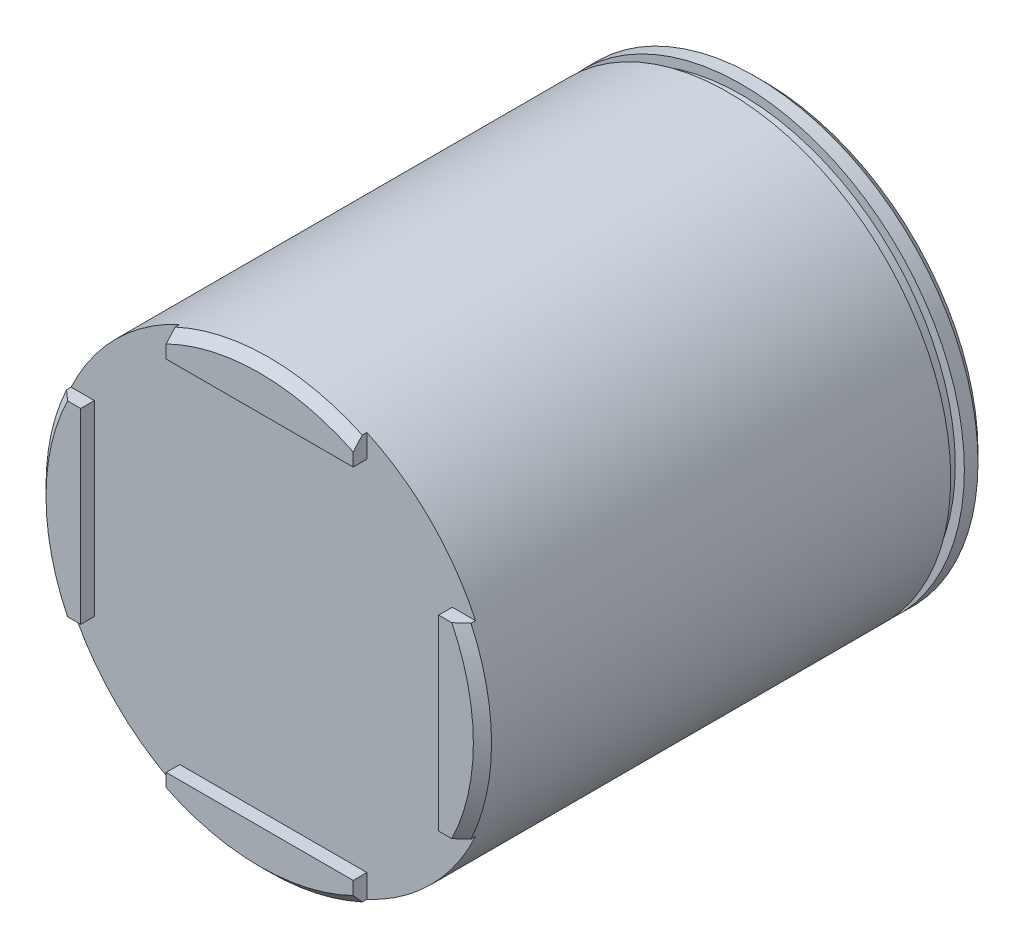
from build123d import *

# Parameters (mm, degrees)
SKETCH2_R                       = 12.446
BOSS_EXTRUDE1_DEPTH             = 28.194
CHAMFER1_SIZE                   = 0.508
F_45_0_082_DIAMETER_HOLE1_D     = 2.0828
F_45_0_082_DIAMETER_HOLE1_DEPTH = 21.59
F_45_0_082_DIAMETER_HOLE1_TIP   = 0.431362004
SKETCH11_W                      = 20
SKETCH11_H                      = 20
CUT_EXTRUDE1_DEPTH              = 0.762
CUT_EXTRUDE2_REACH              = 35.237
SKETCH13_W                      = 22.592421824
SKETCH13_H                      = 4.7752
CUT_EXTRUDE3_REACH              = 35.237
SKETCH14_W                      = 4.7752
SKETCH14_H                      = 22.592421824
CIRPATTERN2_COUNT               = 6
SKETCH18_W                      = 0.762
SKETCH18_H                      = 0.508


with BuildPart() as part:
    # Sketch2 → Boss-Extrude1 (new body)
    with BuildSketch(Plane.XY):
        Circle(SKETCH2_R)
    extrude(amount=BOSS_EXTRUDE1_DEPTH)

    # Chamfer1
    chamfer1_edges = [part.edges().sort_by_distance(p)[0] for p in [
        (-12.446, 0, 0),
        (-12.446, 0, 28.194),
    ]]
    chamfer(chamfer1_edges, length=CHAMFER1_SIZE)

    # #45 (0.082) Diameter Hole1
    with Locations(Plane(origin=(0, 0, 0), x_dir=(-1, 0, 0), z_dir=(0, 0, -1))):
        with Locations((0, 8.255), (-7.149039708, 4.1275), (-7.149039708, -4.1275), (0, -8.255), (7.149039708, -4.1275), (7.149039708, 4.1275)):
            Hole(F_45_0_082_DIAMETER_HOLE1_D / 2, depth=F_45_0_082_DIAMETER_HOLE1_DEPTH)
            with Locations((0, 0, -(F_45_0_082_DIAMETER_HOLE1_DEPTH + F_45_0_082_DIAMETER_HOLE1_TIP / 2))):  # 135° drill point
                Cone(0, F_45_0_082_DIAMETER_HOLE1_D / 2, F_45_0_082_DIAMETER_HOLE1_TIP, mode=Mode.SUBTRACT)

    # Sketch11 → Cut-Extrude1 (cut)
    with BuildSketch(Plane.XY.offset(28.194)):
        Rectangle(SKETCH11_W, SKETCH11_H)
    extrude(amount=-CUT_EXTRUDE1_DEPTH, mode=Mode.SUBTRACT)

    # Cut-Extrude2: up to this face of the body (flat: up to its plane)
    cut_extrude2_end = Plane(part.part.faces().sort_by_distance((0, 0, 27.432))[0])
    # Sketch13 → Cut-Extrude2 (cut, up to the picked face)
    with BuildSketch(Plane.XY.offset(28.194), mode=Mode.PRIVATE) as cut_extrude2_sk1:
        with Locations((0, 7.6124)):
            Rectangle(SKETCH13_W, SKETCH13_H)
    cut_extrude2_tool1 = split(extrude(cut_extrude2_sk1.sketch, amount=-CUT_EXTRUDE2_REACH, mode=Mode.PRIVATE), bisect_by=cut_extrude2_end, keep=Keep.BOTH, mode=Mode.PRIVATE)
    # Sketch13 → Cut-Extrude2 (cut, up to the picked face)
    with BuildSketch(Plane.XY.offset(28.194), mode=Mode.PRIVATE) as cut_extrude2_sk2:
        with Locations((0, -7.6124)):
            Rectangle(SKETCH13_W, SKETCH13_H)
    cut_extrude2_tool2 = split(extrude(cut_extrude2_sk2.sketch, amount=-CUT_EXTRUDE2_REACH, mode=Mode.PRIVATE), bisect_by=cut_extrude2_end, keep=Keep.BOTH, mode=Mode.PRIVATE)
    add(cut_extrude2_tool1.solids().sort_by(Axis((0, 7.6124, 28.194), (0, 0, -1)))[0], mode=Mode.SUBTRACT)
    add(cut_extrude2_tool2.solids().sort_by(Axis((0, -7.6124, 28.194), (0, 0, -1)))[0], mode=Mode.SUBTRACT)

    # Cut-Extrude3: up to this face of the body (flat: up to its plane)
    cut_extrude3_end = Plane(part.part.faces().sort_by_distance((0, 0, 27.432))[0])
    # Sketch14 → Cut-Extrude3 (cut, up to the picked face)
    with BuildSketch(Plane.XY.offset(28.194), mode=Mode.PRIVATE) as cut_extrude3_sk1:
        with Locations((-7.6124, 0)):
            Rectangle(SKETCH14_W, SKETCH14_H)
    cut_extrude3_tool1 = split(extrude(cut_extrude3_sk1.sketch, amount=-CUT_EXTRUDE3_REACH, mode=Mode.PRIVATE), bisect_by=cut_extrude3_end, keep=Keep.BOTH, mode=Mode.PRIVATE)
    # Sketch14 → Cut-Extrude3 (cut, up to the picked face)
    with BuildSketch(Plane.XY.offset(28.194), mode=Mode.PRIVATE) as cut_extrude3_sk2:
        with Locations((7.6124, 0)):
            Rectangle(SKETCH14_W, SKETCH14_H)
    cut_extrude3_tool2 = split(extrude(cut_extrude3_sk2.sketch, amount=-CUT_EXTRUDE3_REACH, mode=Mode.PRIVATE), bisect_by=cut_extrude3_end, keep=Keep.BOTH, mode=Mode.PRIVATE)
    add(cut_extrude3_tool1.solids().sort_by(Axis((-7.6124, 0, 28.194), (0, 0, -1)))[0], mode=Mode.SUBTRACT)
    add(cut_extrude3_tool2.solids().sort_by(Axis((7.6124, 0, 28.194), (0, 0, -1)))[0], mode=Mode.SUBTRACT)

    # Sketch17 → Cut-Revolve2 (revolve, cut)
    with BuildSketch(Plane(origin=(0, 0, 0), x_dir=(0, 0, -1), z_dir=(1, 0, 0)), mode=Mode.PRIVATE) as cut_revolve2_sk:
        Polygon((-20.510254982, 8.255), (-20.510254982, 9.271), (-7.62, 11.255), (0, 11.255), (0, 8.255), (-7.62, 8.255), align=None)
    cut_revolve2 = revolve(cut_revolve2_sk.sketch.rotate(Axis((0, 8.255, 20.510254982), (0, 0, -1)), 270), axis=Axis((0, 8.255, 20.510254982), (0, 0, -1)), mode=Mode.SUBTRACT)

    # CirPattern2: Cut-Revolve2 ×6 about axis
    cirpattern2_axis = Axis((0, 0, 0), (0, 0, 1))
    for i in range(1, CIRPATTERN2_COUNT):
        add(cut_revolve2.rotate(cirpattern2_axis, i * 360 / CIRPATTERN2_COUNT), mode=Mode.SUBTRACT)

    # Sketch18 → Cut-Revolve3 (revolve, cut)
    with BuildSketch(Plane(origin=(0, 0, 0), x_dir=(0, 0, -1), z_dir=(1, 0, 0)), mode=Mode.PRIVATE) as cut_revolve3_sk:
        with Locations((-1.651, 12.192)):
            Rectangle(SKETCH18_W, SKETCH18_H)
    revolve(cut_revolve3_sk.sketch.rotate(Axis((0, 0, 27.686), (0, 0, -1)), 90), axis=Axis((0, 0, 27.686), (0, 0, -1)), mode=Mode.SUBTRACT)


solid = part.part
